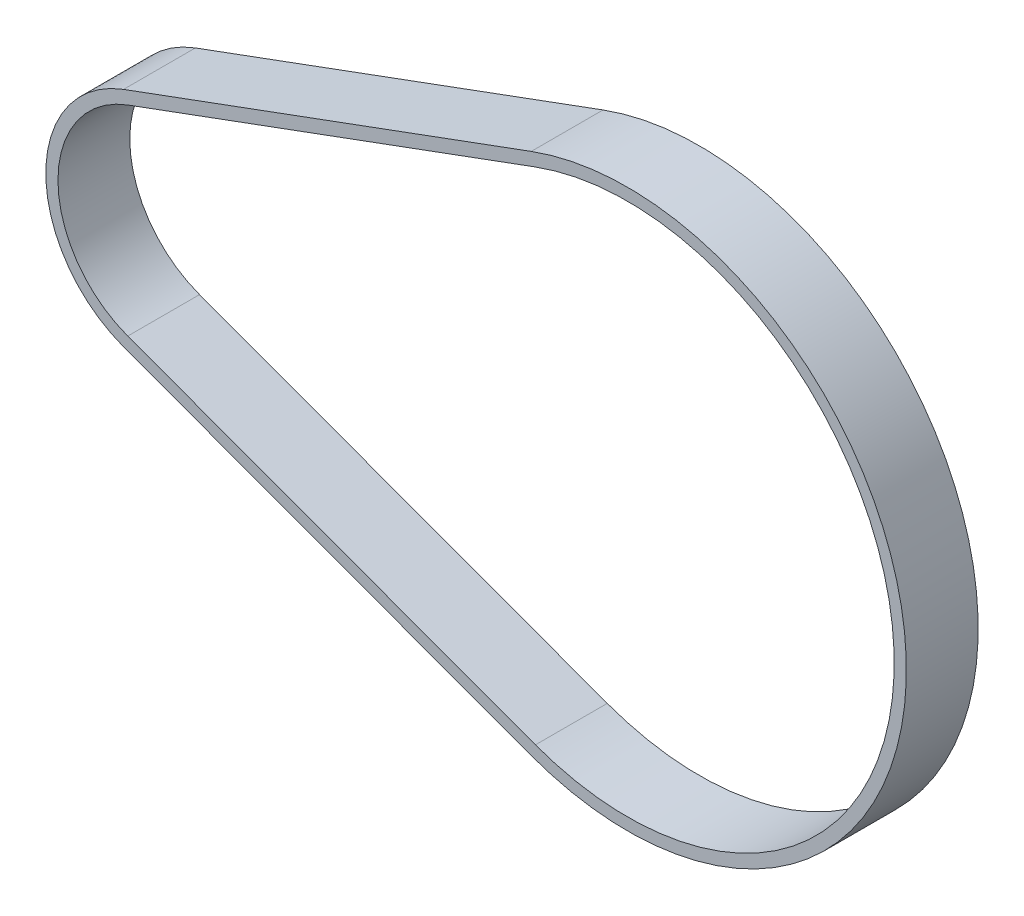
from build123d import *

# Parameters (mm, degrees)
BOSS_EXTRUDE1_DEPTH = 15


with BuildPart() as part:
    # Sketch1 → Boss-Extrude1 (new body)
    with BuildSketch(Plane.XY):
        with BuildLine():
            Line((76.595380882, -54.653680191), (-8.576048529, -23.286805733))
            ThreePointArc((-8.576048529, -23.286805733), (-24.8158, 0), (-8.576048529, 23.286805733))
            Line((-8.576048529, 23.286805733), (76.595380882, 54.653680191))
            ThreePointArc((76.595380882, 54.653680191), (154.9654, 0), (76.595380882, -54.653680191))
        make_face()
        with BuildLine():
            Line((77.473175, -52.270179092), (-7.698254412, -20.903304635))
            ThreePointArc((-7.698254412, -20.903304635), (-22.2758, 0), (-7.698254412, 20.903304635))
            Line((-7.698254412, 20.903304635), (77.473175, 52.270179092))
            ThreePointArc((77.473175, 52.270179092), (152.4254, 0), (77.473175, -52.270179092))
        make_face(mode=Mode.SUBTRACT)
    extrude(amount=BOSS_EXTRUDE1_DEPTH)


solid = part.part
